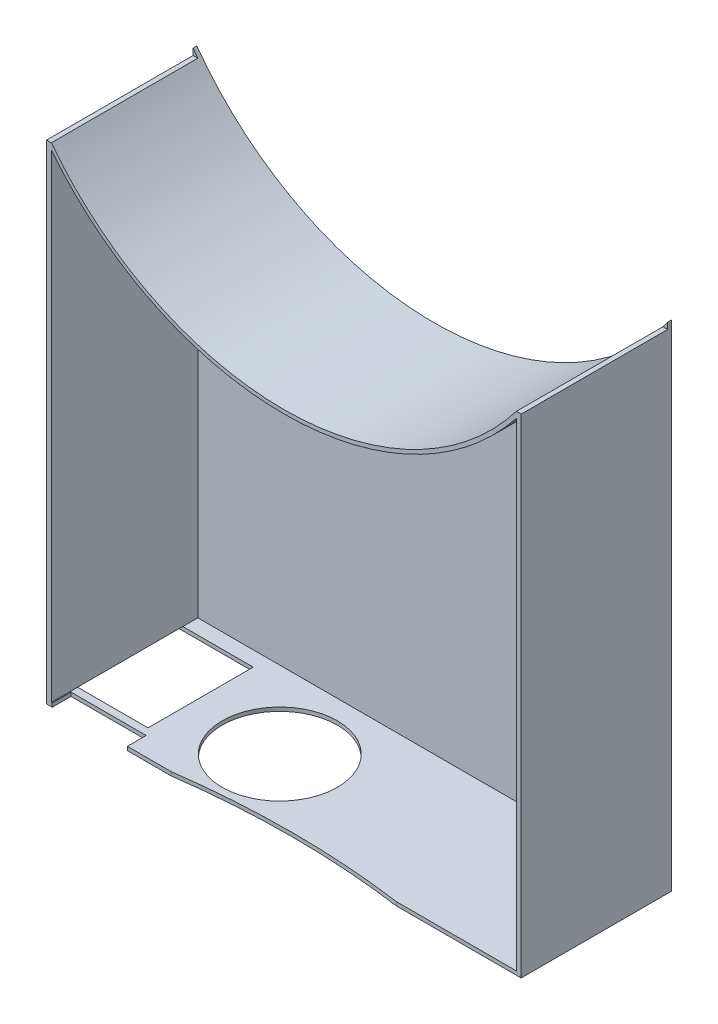
from build123d import *

# Parameters (mm, degrees)
BOSS_EXTRUDE1_DEPTH     = 40
SKETCH3_W               = 1.255387907
SKETCH3_H               = 40
BOSS_EXTRUDE2_DEPTH     = 130
SKETCH4_W               = 126.316334496
SKETCH4_H               = 1
BOSS_EXTRUDE3_DEPTH     = 150
SKETCH5_R               = 78
CUT_EXTRUDE3_DEPTH      = 90
SKETCH6_W               = 126.316334496
SKETCH6_H               = 1
BOSS_EXTRUDE4_DEPTH     = 39
CUT_EXTRUDE4_DEPTH      = 39
CUT_EXTRUDE5_DEPTH      = 152.425375183
CUT_EXTRUDE5_DEPTH_BACK = 1
SKETCH8_W               = 20
SKETCH8_H               = 5
SKETCH8_H_2             = 28
SKETCH9_R               = 15.335640517
CUT_EXTRUDE6_DEPTH      = 1


with BuildPart() as part:
    # Sketch2 → Boss-Extrude1 (new body)
    with BuildSketch(Plane.XY):
        with BuildLine():
            Line((61.902779341, -47.455725786), (63.158167248, -47.455725786))
            ThreePointArc((63.158167248, -47.455725786), (0, -79), (-63.158167248, -47.455725786))
            Line((-63.158167248, -47.455725786), (-61.902779341, -47.455725786))
            ThreePointArc((-61.902779341, -47.455725786), (0, -78), (61.902779341, -47.455725786))
        make_face()
    extrude(amount=-BOSS_EXTRUDE1_DEPTH)

    # Sketch3 → Boss-Extrude2 (add)
    with BuildSketch(Plane(origin=(0, -47.455725786, 0), x_dir=(1, 0, 0), z_dir=(0, 1, 0))):
        with Locations((-62.530473295, 20)):
            Rectangle(SKETCH3_W, SKETCH3_H)
        with Locations((62.530473295, 20)):
            Rectangle(SKETCH3_W, SKETCH3_H)
    extrude(amount=-BOSS_EXTRUDE2_DEPTH)

    # Sketch4 → Boss-Extrude3 (add)
    with BuildSketch(Plane.XZ.offset(177.455725786)):
        with Locations((0, -39.5)):
            Rectangle(SKETCH4_W, SKETCH4_H)
    extrude(amount=-BOSS_EXTRUDE3_DEPTH)

    # Sketch5 → Cut-Extrude3 (cut)
    with BuildSketch(Plane.XY.offset(-39)):
        Circle(SKETCH5_R)
    extrude(amount=-CUT_EXTRUDE3_DEPTH, mode=Mode.SUBTRACT)

    # Sketch6 → Boss-Extrude4 (add)
    with BuildSketch(Plane.XY.offset(-39)):
        with Locations((0, -176.955725786)):
            Rectangle(SKETCH6_W, SKETCH6_H)
    extrude(amount=BOSS_EXTRUDE4_DEPTH)

    # Sketch7 → Cut-Extrude4 (cut)
    with BuildSketch(Plane.XZ.offset(177.455725786)):
        with BuildLine():
            Line((0, 0), (-30, 0))
            ThreePointArc((-30, 0), (0, -2.075596442), (30, 0))
            Line((30, 0), (0, 0))
        make_face()
    extrude(amount=-CUT_EXTRUDE4_DEPTH, mode=Mode.SUBTRACT)

    # Sketch8 → Cut-Extrude5 (cut, two sides: drawn at the far end of the back side and taken through both)
    with BuildSketch(Plane.XZ.offset(177.455725786).offset(-CUT_EXTRUDE5_DEPTH_BACK)):
        with Locations((-51.658167248, -2.5)):
            Rectangle(SKETCH8_W, SKETCH8_H)
        with Locations((-53.158167248, -21)):
            Rectangle(SKETCH8_W, SKETCH8_H_2)
    extrude(amount=CUT_EXTRUDE5_DEPTH + CUT_EXTRUDE5_DEPTH_BACK, mode=Mode.SUBTRACT)

    # Sketch9 → Cut-Extrude6 (cut)
    with BuildSketch(Plane.XZ.offset(177.455725786)):
        with Locations(Location((-19.587676617, -18.499331227, 0), (0, 0, 270))):
            Circle(SKETCH9_R)
    extrude(amount=-CUT_EXTRUDE6_DEPTH, mode=Mode.SUBTRACT)


solid = part.part
